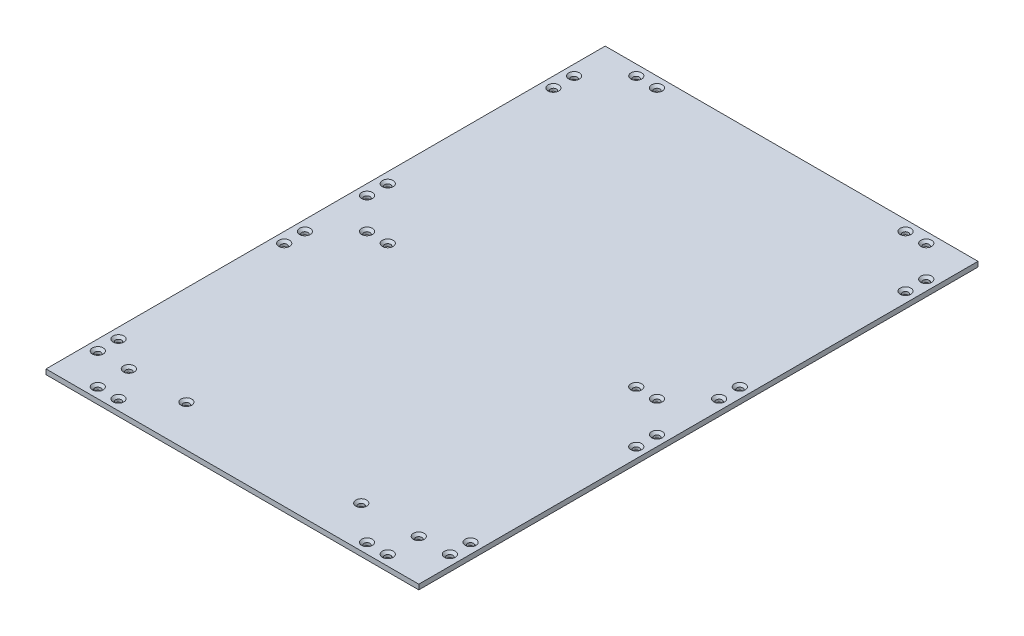
from build123d import *

# Parameters (mm, degrees)
SKETCH1_W                                      = 360
SKETCH1_H                                      = 540
BOSS_EXTRUDE1_DEPTH                            = 4.826
CSK_FOR_M5_FLAT_HEAD_MACHINE_SCREW1_AT_2_COUNT = 2
CSK_FOR_M5_FLAT_HEAD_MACHINE_SCREW1_AT_2_PITCH = 55.5625
CSK_FOR_M5_FLAT_HEAD_MACHINE_SCREW1_AT_3_COUNT = 2
CSK_FOR_M5_FLAT_HEAD_MACHINE_SCREW1_AT_3_PITCH = 224.4375
CSK_FOR_M5_FLAT_HEAD_MACHINE_SCREW1_AT_4_COUNT = 2
CSK_FOR_M5_FLAT_HEAD_MACHINE_SCREW1_AT_4_PITCH = 280
CSK_FOR_M5_FLAT_HEAD_MACHINE_SCREW2_AT_2_COUNT = 2
CSK_FOR_M5_FLAT_HEAD_MACHINE_SCREW2_AT_2_PITCH = 42.426406871
CSK_FOR_M5_FLAT_HEAD_MACHINE_SCREW2_AT_3_COUNT = 2
CSK_FOR_M5_FLAT_HEAD_MACHINE_SCREW2_AT_3_PITCH = 280
CSK_FOR_M5_FLAT_HEAD_MACHINE_SCREW2_AT_4_COUNT = 2
CSK_FOR_M5_FLAT_HEAD_MACHINE_SCREW2_AT_4_PITCH = 311.448230048
CSK_FOR_M5_FLAT_HEAD_MACHINE_SCREW2_AT_5_COUNT = 2
CSK_FOR_M5_FLAT_HEAD_MACHINE_SCREW2_AT_5_PITCH = 231.948270095
CSK_FOR_M5_FLAT_HEAD_MACHINE_SCREW2_AT_6_COUNT = 2
CSK_FOR_M5_FLAT_HEAD_MACHINE_SCREW2_AT_6_PITCH = 260
CSK_FOR_M5_FLAT_HEAD_MACHINE_SCREW2_AT_7_COUNT = 2
CSK_FOR_M5_FLAT_HEAD_MACHINE_SCREW2_AT_7_PITCH = 291.547594742
CSK_FOR_M5_FLAT_HEAD_MACHINE_SCREW2_AT_8_COUNT = 2
CSK_FOR_M5_FLAT_HEAD_MACHINE_SCREW2_AT_8_PITCH = 386.005181312
CSK_FOR_M5_FLAT_HEAD_MACHINE_SCREW2_AT_9_COUNT = 2
CSK_FOR_M5_FLAT_HEAD_MACHINE_SCREW2_AT_9_PITCH = 382.099463491
CSK_FOR_M5_FLAT_HEAD_MACHINE_SCREW2_AT_1_COUNT = 2
CSK_FOR_M5_FLAT_HEAD_MACHINE_SCREW2_AT_1_PITCH = 424.499705536
CSK_FOR_M5_FLAT_HEAD_MACHINE_SCREW2_2_COUNT    = 2
CSK_FOR_M5_FLAT_HEAD_MACHINE_SCREW2_2_PITCH    = 490.917508345
CSK_FOR_M5_FLAT_HEAD_MACHINE_SCREW2_3_COUNT    = 2
CSK_FOR_M5_FLAT_HEAD_MACHINE_SCREW2_3_PITCH    = 520
CSK_FOR_M5_FLAT_HEAD_MACHINE_SCREW2_4_COUNT    = 2
CSK_FOR_M5_FLAT_HEAD_MACHINE_SCREW2_4_PITCH    = 590.592922409
CSK_FOR_M5_FLAT_HEAD_MACHINE_SCREW2_5_COUNT    = 2
CSK_FOR_M5_FLAT_HEAD_MACHINE_SCREW2_5_PITCH    = 579.827560573
CSK_FOR_M5_FLAT_HEAD_MACHINE_SCREW2_6_COUNT    = 2
CSK_FOR_M5_FLAT_HEAD_MACHINE_SCREW2_6_PITCH    = 470.956473573
CSK_FOR_M5_FLAT_HEAD_MACHINE_SCREW2_7_COUNT    = 2
CSK_FOR_M5_FLAT_HEAD_MACHINE_SCREW2_7_PITCH    = 520.38447325
CSK_FOR_M5_FLAT_HEAD_MACHINE_SCREW2_8_COUNT    = 2
CSK_FOR_M5_FLAT_HEAD_MACHINE_SCREW2_8_PITCH    = 581.37767415
CSK_FOR_M5_FLAT_HEAD_MACHINE_SCREW2_9_COUNT    = 2
CSK_FOR_M5_FLAT_HEAD_MACHINE_SCREW2_9_PITCH    = 563.02753041
CSK_FOR_M5_FLAT_HEAD_MACHINE_SCREW2_10_COUNT   = 2
CSK_FOR_M5_FLAT_HEAD_MACHINE_SCREW2_10_PITCH   = 438.406204336
CSK_FOR_M5_FLAT_HEAD_MACHINE_SCREW2_11_COUNT   = 2
CSK_FOR_M5_FLAT_HEAD_MACHINE_SCREW2_11_PITCH   = 367.695526217
CSK_FOR_M5_FLAT_HEAD_MACHINE_SCREW2_12_COUNT   = 2
CSK_FOR_M5_FLAT_HEAD_MACHINE_SCREW2_12_PITCH   = 374.432904537
CSK_FOR_M5_FLAT_HEAD_MACHINE_SCREW2_13_COUNT   = 2
CSK_FOR_M5_FLAT_HEAD_MACHINE_SCREW2_13_PITCH   = 212.132034356
CSK_FOR_M5_FLAT_HEAD_MACHINE_SCREW2_14_COUNT   = 2
CSK_FOR_M5_FLAT_HEAD_MACHINE_SCREW2_14_PITCH   = 260.768096208
CSK_FOR_M5_FLAT_HEAD_MACHINE_SCREW2_15_COUNT   = 2
CSK_FOR_M5_FLAT_HEAD_MACHINE_SCREW2_15_PITCH   = 311.448230048
CSK_FOR_M5_FLAT_HEAD_MACHINE_SCREW2_16_COUNT   = 2
CSK_FOR_M5_FLAT_HEAD_MACHINE_SCREW2_16_PITCH   = 58.309518948
CSK_FOR_M5_FLAT_HEAD_MACHINE_SCREW2_17_COUNT   = 2
CSK_FOR_M5_FLAT_HEAD_MACHINE_SCREW2_17_PITCH   = 20
CSK_FOR_M5_FLAT_HEAD_MACHINE_SCREW2_18_COUNT   = 2
CSK_FOR_M5_FLAT_HEAD_MACHINE_SCREW2_18_PITCH   = 260
CSK_FOR_M5_FLAT_HEAD_MACHINE_SCREW2_19_COUNT   = 2
CSK_FOR_M5_FLAT_HEAD_MACHINE_SCREW2_19_PITCH   = 314.006369362


with BuildPart() as part:
    # Sketch1 → Boss-Extrude1 (new body)
    with BuildSketch(Plane(origin=(0, 0, 0), x_dir=(1, 0, 0), z_dir=(0, 1, 0))):
        with Locations((180, 270)):
            Rectangle(SKETCH1_W, SKETCH1_H)
    extrude(amount=BOSS_EXTRUDE1_DEPTH)

    # Sketch16 → CSK for M5 Flat Head Machine Screw1 (revolve, cut)
    with BuildSketch(Plane(origin=(40, 4.826, -40), x_dir=(0, 0, 1), z_dir=(1, 0, 0))):
        Polygon((0, 0), (0, 4.826), (2.9, 4.826), (2.9, 2.3), (5.2, 0), align=None)
    csk_for_m5_flat_head_machine_screw1 = revolve(axis=Axis((40, 11.176, -40), (0, -1, 0)), mode=Mode.SUBTRACT)

    # CSK for M5 Flat Head Machine Screw1 at 2: CSK for M5 Flat Head Machine Screw1 ×2
    with Locations(*[(i * CSK_FOR_M5_FLAT_HEAD_MACHINE_SCREW1_AT_2_PITCH, 0, 0) for i in range(1, CSK_FOR_M5_FLAT_HEAD_MACHINE_SCREW1_AT_2_COUNT)]):
        add(csk_for_m5_flat_head_machine_screw1, mode=Mode.SUBTRACT)

    # CSK for M5 Flat Head Machine Screw1 at 3: CSK for M5 Flat Head Machine Screw1 ×2
    with Locations(*[(i * CSK_FOR_M5_FLAT_HEAD_MACHINE_SCREW1_AT_3_PITCH, 0, 0) for i in range(1, CSK_FOR_M5_FLAT_HEAD_MACHINE_SCREW1_AT_3_COUNT)]):
        add(csk_for_m5_flat_head_machine_screw1, mode=Mode.SUBTRACT)

    # CSK for M5 Flat Head Machine Screw1 at 4: CSK for M5 Flat Head Machine Screw1 ×2
    with Locations(*[(i * CSK_FOR_M5_FLAT_HEAD_MACHINE_SCREW1_AT_4_PITCH, 0, 0) for i in range(1, CSK_FOR_M5_FLAT_HEAD_MACHINE_SCREW1_AT_4_COUNT)]):
        add(csk_for_m5_flat_head_machine_screw1, mode=Mode.SUBTRACT)

    # Sketch20 → CSK for M5 Flat Head Machine Screw2 (revolve, cut)
    with BuildSketch(Plane(origin=(40, 4.826, -10), x_dir=(0, 0, 1), z_dir=(1, 0, 0))):
        Polygon((0, 0), (0, 4.826), (2.9, 4.826), (2.9, 2.3), (5.2, 0), align=None)
    csk_for_m5_flat_head_machine_screw2 = revolve(axis=Axis((40, 11.176, -10), (0, -1, 0)), mode=Mode.SUBTRACT)

    # CSK for M5 Flat Head Machine Screw2 at 2: CSK for M5 Flat Head Machine Screw2 ×2
    with Locations(*[Vector(-0.7071067811865477, 0, -0.7071067811865475) * (i * CSK_FOR_M5_FLAT_HEAD_MACHINE_SCREW2_AT_2_PITCH) for i in range(1, CSK_FOR_M5_FLAT_HEAD_MACHINE_SCREW2_AT_2_COUNT)]):
        add(csk_for_m5_flat_head_machine_screw2, mode=Mode.SUBTRACT)

    # CSK for M5 Flat Head Machine Screw2 at 3: CSK for M5 Flat Head Machine Screw2 ×2
    with Locations(*[(i * CSK_FOR_M5_FLAT_HEAD_MACHINE_SCREW2_AT_3_PITCH, 0, 0) for i in range(1, CSK_FOR_M5_FLAT_HEAD_MACHINE_SCREW2_AT_3_COUNT)]):
        add(csk_for_m5_flat_head_machine_screw2, mode=Mode.SUBTRACT)

    # CSK for M5 Flat Head Machine Screw2 at 4: CSK for M5 Flat Head Machine Screw2 ×2
    with Locations(*[Vector(0.9953500135553002, 0, -0.09632419486019045) * (i * CSK_FOR_M5_FLAT_HEAD_MACHINE_SCREW2_AT_4_PITCH) for i in range(1, CSK_FOR_M5_FLAT_HEAD_MACHINE_SCREW2_AT_4_COUNT)]):
        add(csk_for_m5_flat_head_machine_screw2, mode=Mode.SUBTRACT)

    # CSK for M5 Flat Head Machine Screw2 at 5: CSK for M5 Flat Head Machine Screw2 ×2
    with Locations(*[Vector(-0.12933918406776806, 0, -0.9916004111862218) * (i * CSK_FOR_M5_FLAT_HEAD_MACHINE_SCREW2_AT_5_PITCH) for i in range(1, CSK_FOR_M5_FLAT_HEAD_MACHINE_SCREW2_AT_5_COUNT)]):
        add(csk_for_m5_flat_head_machine_screw2, mode=Mode.SUBTRACT)

    # CSK for M5 Flat Head Machine Screw2 at 6: CSK for M5 Flat Head Machine Screw2 ×2
    with Locations(*[(0, 0, -i * CSK_FOR_M5_FLAT_HEAD_MACHINE_SCREW2_AT_6_PITCH) for i in range(1, CSK_FOR_M5_FLAT_HEAD_MACHINE_SCREW2_AT_6_COUNT)]):
        add(csk_for_m5_flat_head_machine_screw2, mode=Mode.SUBTRACT)

    # CSK for M5 Flat Head Machine Screw2 at 7: CSK for M5 Flat Head Machine Screw2 ×2
    with Locations(*[Vector(-0.10289915108550529, 0, -0.9946917938265514) * (i * CSK_FOR_M5_FLAT_HEAD_MACHINE_SCREW2_AT_7_PITCH) for i in range(1, CSK_FOR_M5_FLAT_HEAD_MACHINE_SCREW2_AT_7_COUNT)]):
        add(csk_for_m5_flat_head_machine_screw2, mode=Mode.SUBTRACT)

    # CSK for M5 Flat Head Machine Screw2 at 8: CSK for M5 Flat Head Machine Screw2 ×2
    with Locations(*[Vector(0.8030980282338017, 0, -0.5958469241734659) * (i * CSK_FOR_M5_FLAT_HEAD_MACHINE_SCREW2_AT_8_PITCH) for i in range(1, CSK_FOR_M5_FLAT_HEAD_MACHINE_SCREW2_AT_8_COUNT)]):
        add(csk_for_m5_flat_head_machine_screw2, mode=Mode.SUBTRACT)

    # CSK for M5 Flat Head Machine Screw2 at 9: CSK for M5 Flat Head Machine Screw2 ×2
    with Locations(*[Vector(0.7327934916262991, 0, -0.680451099367278) * (i * CSK_FOR_M5_FLAT_HEAD_MACHINE_SCREW2_AT_9_PITCH) for i in range(1, CSK_FOR_M5_FLAT_HEAD_MACHINE_SCREW2_AT_9_COUNT)]):
        add(csk_for_m5_flat_head_machine_screw2, mode=Mode.SUBTRACT)

    # CSK for M5 Flat Head Machine Screw2 at 1: CSK for M5 Flat Head Machine Screw2 ×2
    with Locations(*[Vector(0.7302714135188955, 0, -0.683157128775741) * (i * CSK_FOR_M5_FLAT_HEAD_MACHINE_SCREW2_AT_1_PITCH) for i in range(1, CSK_FOR_M5_FLAT_HEAD_MACHINE_SCREW2_AT_1_COUNT)]):
        add(csk_for_m5_flat_head_machine_screw2, mode=Mode.SUBTRACT)

    # CSK for M5 Flat Head Machine Screw2  2: CSK for M5 Flat Head Machine Screw2 ×2
    with Locations(*[Vector(-0.0611100632795033, 0, -0.9981310335652204) * (i * CSK_FOR_M5_FLAT_HEAD_MACHINE_SCREW2_2_PITCH) for i in range(1, CSK_FOR_M5_FLAT_HEAD_MACHINE_SCREW2_2_COUNT)]):
        add(csk_for_m5_flat_head_machine_screw2, mode=Mode.SUBTRACT)

    # CSK for M5 Flat Head Machine Screw2  3: CSK for M5 Flat Head Machine Screw2 ×2
    with Locations(*[(0, 0, -i * CSK_FOR_M5_FLAT_HEAD_MACHINE_SCREW2_3_PITCH) for i in range(1, CSK_FOR_M5_FLAT_HEAD_MACHINE_SCREW2_3_COUNT)]):
        add(csk_for_m5_flat_head_machine_screw2, mode=Mode.SUBTRACT)

    # CSK for M5 Flat Head Machine Screw2  4: CSK for M5 Flat Head Machine Screw2 ×2
    with Locations(*[Vector(0.4740998230350174, 0, -0.8804710999221753) * (i * CSK_FOR_M5_FLAT_HEAD_MACHINE_SCREW2_4_PITCH) for i in range(1, CSK_FOR_M5_FLAT_HEAD_MACHINE_SCREW2_4_COUNT)]):
        add(csk_for_m5_flat_head_machine_screw2, mode=Mode.SUBTRACT)

    # CSK for M5 Flat Head Machine Screw2  5: CSK for M5 Flat Head Machine Screw2 ×2
    with Locations(*[Vector(0.5346417126044627, 0, -0.8450788360522153) * (i * CSK_FOR_M5_FLAT_HEAD_MACHINE_SCREW2_5_PITCH) for i in range(1, CSK_FOR_M5_FLAT_HEAD_MACHINE_SCREW2_5_COUNT)]):
        add(csk_for_m5_flat_head_machine_screw2, mode=Mode.SUBTRACT)

    # CSK for M5 Flat Head Machine Screw2  6: CSK for M5 Flat Head Machine Screw2 ×2
    with Locations(*[Vector(-0.06370015422533803, 0, -0.9979690828636267) * (i * CSK_FOR_M5_FLAT_HEAD_MACHINE_SCREW2_6_PITCH) for i in range(1, CSK_FOR_M5_FLAT_HEAD_MACHINE_SCREW2_6_COUNT)]):
        add(csk_for_m5_flat_head_machine_screw2, mode=Mode.SUBTRACT)

    # CSK for M5 Flat Head Machine Screw2  7: CSK for M5 Flat Head Machine Screw2 ×2
    with Locations(*[Vector(0.03843312210120418, 0, -0.9992611746313144) * (i * CSK_FOR_M5_FLAT_HEAD_MACHINE_SCREW2_7_PITCH) for i in range(1, CSK_FOR_M5_FLAT_HEAD_MACHINE_SCREW2_7_COUNT)]):
        add(csk_for_m5_flat_head_machine_screw2, mode=Mode.SUBTRACT)

    # CSK for M5 Flat Head Machine Screw2  8: CSK for M5 Flat Head Machine Screw2 ×2
    with Locations(*[Vector(0.4472135954999574, 0, -0.8944271909999162) * (i * CSK_FOR_M5_FLAT_HEAD_MACHINE_SCREW2_8_PITCH) for i in range(1, CSK_FOR_M5_FLAT_HEAD_MACHINE_SCREW2_8_COUNT)]):
        add(csk_for_m5_flat_head_machine_screw2, mode=Mode.SUBTRACT)

    # CSK for M5 Flat Head Machine Screw2  9: CSK for M5 Flat Head Machine Screw2 ×2
    with Locations(*[Vector(0.5505947458271752, 0, -0.8347726791573312) * (i * CSK_FOR_M5_FLAT_HEAD_MACHINE_SCREW2_9_PITCH) for i in range(1, CSK_FOR_M5_FLAT_HEAD_MACHINE_SCREW2_9_COUNT)]):
        add(csk_for_m5_flat_head_machine_screw2, mode=Mode.SUBTRACT)

    # CSK for M5 Flat Head Machine Screw2  10: CSK for M5 Flat Head Machine Screw2 ×2
    with Locations(*[Vector(0.7071067811865475, 0, -0.7071067811865476) * (i * CSK_FOR_M5_FLAT_HEAD_MACHINE_SCREW2_10_PITCH) for i in range(1, CSK_FOR_M5_FLAT_HEAD_MACHINE_SCREW2_10_COUNT)]):
        add(csk_for_m5_flat_head_machine_screw2, mode=Mode.SUBTRACT)

    # CSK for M5 Flat Head Machine Screw2  11: CSK for M5 Flat Head Machine Screw2 ×2
    with Locations(*[Vector(0.7071067811865476, 0, -0.7071067811865476) * (i * CSK_FOR_M5_FLAT_HEAD_MACHINE_SCREW2_11_PITCH) for i in range(1, CSK_FOR_M5_FLAT_HEAD_MACHINE_SCREW2_11_COUNT)]):
        add(csk_for_m5_flat_head_machine_screw2, mode=Mode.SUBTRACT)

    # CSK for M5 Flat Head Machine Screw2  12: CSK for M5 Flat Head Machine Screw2 ×2
    with Locations(*[Vector(0.827918690488332, 0, -0.5608481451695152) * (i * CSK_FOR_M5_FLAT_HEAD_MACHINE_SCREW2_12_PITCH) for i in range(1, CSK_FOR_M5_FLAT_HEAD_MACHINE_SCREW2_12_COUNT)]):
        add(csk_for_m5_flat_head_machine_screw2, mode=Mode.SUBTRACT)

    # CSK for M5 Flat Head Machine Screw2  13: CSK for M5 Flat Head Machine Screw2 ×2
    with Locations(*[Vector(-0.14142135623730953, 0, -0.9899494936611666) * (i * CSK_FOR_M5_FLAT_HEAD_MACHINE_SCREW2_13_PITCH) for i in range(1, CSK_FOR_M5_FLAT_HEAD_MACHINE_SCREW2_13_COUNT)]):
        add(csk_for_m5_flat_head_machine_screw2, mode=Mode.SUBTRACT)

    # CSK for M5 Flat Head Machine Screw2  14: CSK for M5 Flat Head Machine Screw2 ×2
    with Locations(*[Vector(0.07669649888473705, 0, -0.9970544855015816) * (i * CSK_FOR_M5_FLAT_HEAD_MACHINE_SCREW2_14_PITCH) for i in range(1, CSK_FOR_M5_FLAT_HEAD_MACHINE_SCREW2_14_COUNT)]):
        add(csk_for_m5_flat_head_machine_screw2, mode=Mode.SUBTRACT)

    # CSK for M5 Flat Head Machine Screw2  15: CSK for M5 Flat Head Machine Screw2 ×2
    with Locations(*[Vector(-0.09632419486019039, 0, -0.9953500135553002) * (i * CSK_FOR_M5_FLAT_HEAD_MACHINE_SCREW2_15_PITCH) for i in range(1, CSK_FOR_M5_FLAT_HEAD_MACHINE_SCREW2_15_COUNT)]):
        add(csk_for_m5_flat_head_machine_screw2, mode=Mode.SUBTRACT)

    # CSK for M5 Flat Head Machine Screw2  16: CSK for M5 Flat Head Machine Screw2 ×2
    with Locations(*[Vector(-0.5144957554275267, 0, -0.8574929257125442) * (i * CSK_FOR_M5_FLAT_HEAD_MACHINE_SCREW2_16_PITCH) for i in range(1, CSK_FOR_M5_FLAT_HEAD_MACHINE_SCREW2_16_COUNT)]):
        add(csk_for_m5_flat_head_machine_screw2, mode=Mode.SUBTRACT)

    # CSK for M5 Flat Head Machine Screw2  17: CSK for M5 Flat Head Machine Screw2 ×2
    with Locations(*[(i * CSK_FOR_M5_FLAT_HEAD_MACHINE_SCREW2_17_PITCH, 0, 0) for i in range(1, CSK_FOR_M5_FLAT_HEAD_MACHINE_SCREW2_17_COUNT)]):
        add(csk_for_m5_flat_head_machine_screw2, mode=Mode.SUBTRACT)

    # CSK for M5 Flat Head Machine Screw2  18: CSK for M5 Flat Head Machine Screw2 ×2
    with Locations(*[(i * CSK_FOR_M5_FLAT_HEAD_MACHINE_SCREW2_18_PITCH, 0, 0) for i in range(1, CSK_FOR_M5_FLAT_HEAD_MACHINE_SCREW2_18_COUNT)]):
        add(csk_for_m5_flat_head_machine_screw2, mode=Mode.SUBTRACT)

    # CSK for M5 Flat Head Machine Screw2  19: CSK for M5 Flat Head Machine Screw2 ×2
    with Locations(*[Vector(0.9872411207126471, 0, -0.1592324388246205) * (i * CSK_FOR_M5_FLAT_HEAD_MACHINE_SCREW2_19_PITCH) for i in range(1, CSK_FOR_M5_FLAT_HEAD_MACHINE_SCREW2_19_COUNT)]):
        add(csk_for_m5_flat_head_machine_screw2, mode=Mode.SUBTRACT)


solid = part.part
